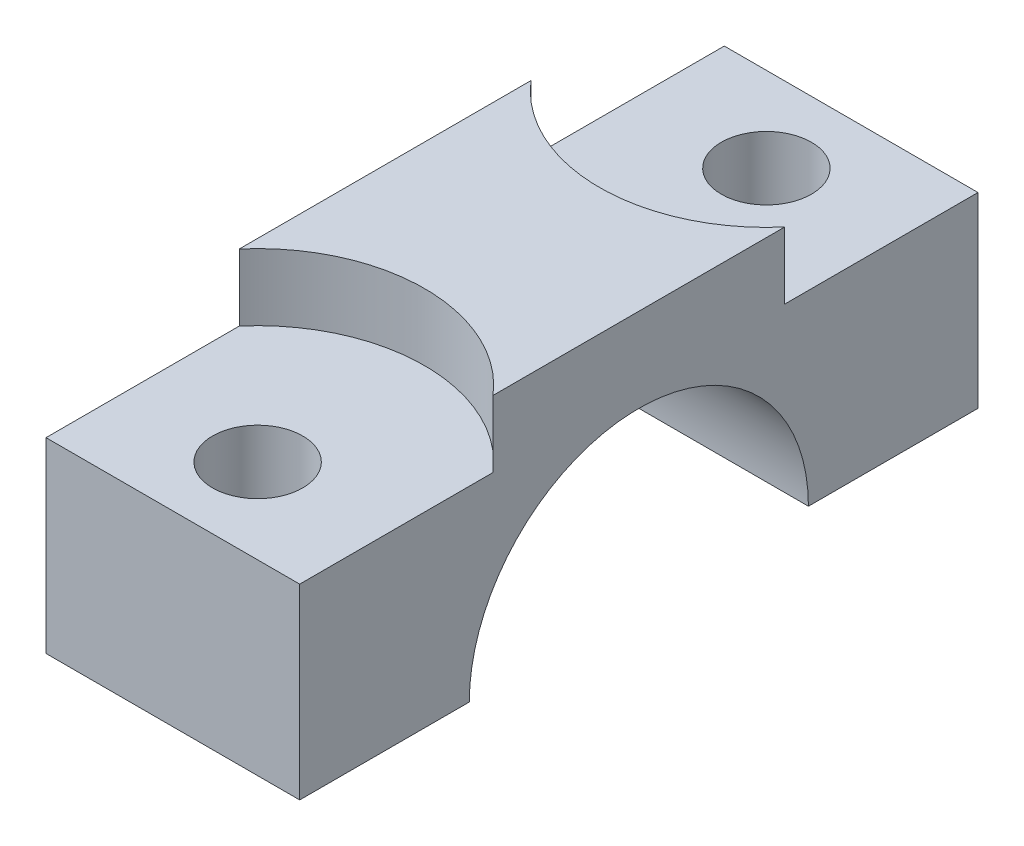
from build123d import *

# Parameters (mm, degrees)
BOSS_EXTRUDE1_DEPTH                           = 9.5
CBORE_FOR_M12_HEX_HEAD_CAP_SCREW1_D           = 6.75
CBORE_FOR_M12_HEX_HEAD_CAP_SCREW1_CBORE_D     = 25
CBORE_FOR_M12_HEX_HEAD_CAP_SCREW1_CBORE_DEPTH = 5


with BuildPart() as part:
    # Sketch1 → Boss-Extrude1 (new, symmetric)
    with BuildSketch(Plane(origin=(0, 0, 0), x_dir=(0, 0, -1), z_dir=(1, 0, 0))):
        with BuildLine():
            ThreePointArc((-12.7, 0), (0, 12.7), (12.7, 0))
            Line((12.7, 0), (25.4, 0))
            Line((25.4, 0), (25.4, 19))
            Line((25.4, 19), (-25.4, 19))
            Line((-25.4, 19), (-25.4, 0))
            Line((-25.4, 0), (-12.7, 0))
        make_face()
    extrude(amount=BOSS_EXTRUDE1_DEPTH, both=True)

    # CBORE for M12 Hex Head Cap Screw1 (through all)
    with Locations(Plane(origin=(0, 19, 0), x_dir=(1, 0, 0), z_dir=(0, 1, 0))):
        with Locations((0, 19.05), (0, -19.05)):
            CounterBoreHole(CBORE_FOR_M12_HEX_HEAD_CAP_SCREW1_D / 2, CBORE_FOR_M12_HEX_HEAD_CAP_SCREW1_CBORE_D / 2, CBORE_FOR_M12_HEX_HEAD_CAP_SCREW1_CBORE_DEPTH)


solid = part.part
